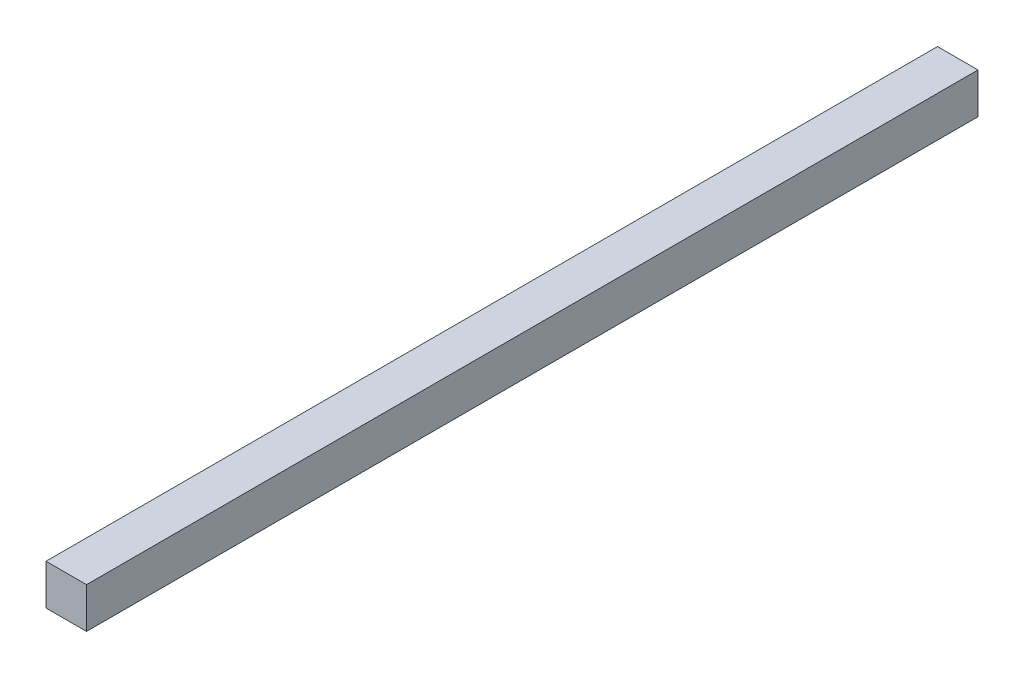
from build123d import *

# Parameters (mm, degrees)
PRESS_KOVA_KIZAGI_SOL_1_START = -60
SKETCH1_W                     = 20
SKETCH1_H                     = 20
PRESS_KOVA_KIZAGI_SOL_1_DEPTH = 440


with BuildPart() as part:
    # Sketch1 → PRESS_kova_kizagi_sol_1 (new body)
    with BuildSketch(Plane.XY.offset(PRESS_KOVA_KIZAGI_SOL_1_START)):
        with Locations((30, 1310)):
            Rectangle(SKETCH1_W, SKETCH1_H)
    extrude(amount=-PRESS_KOVA_KIZAGI_SOL_1_DEPTH)


solid = part.part
